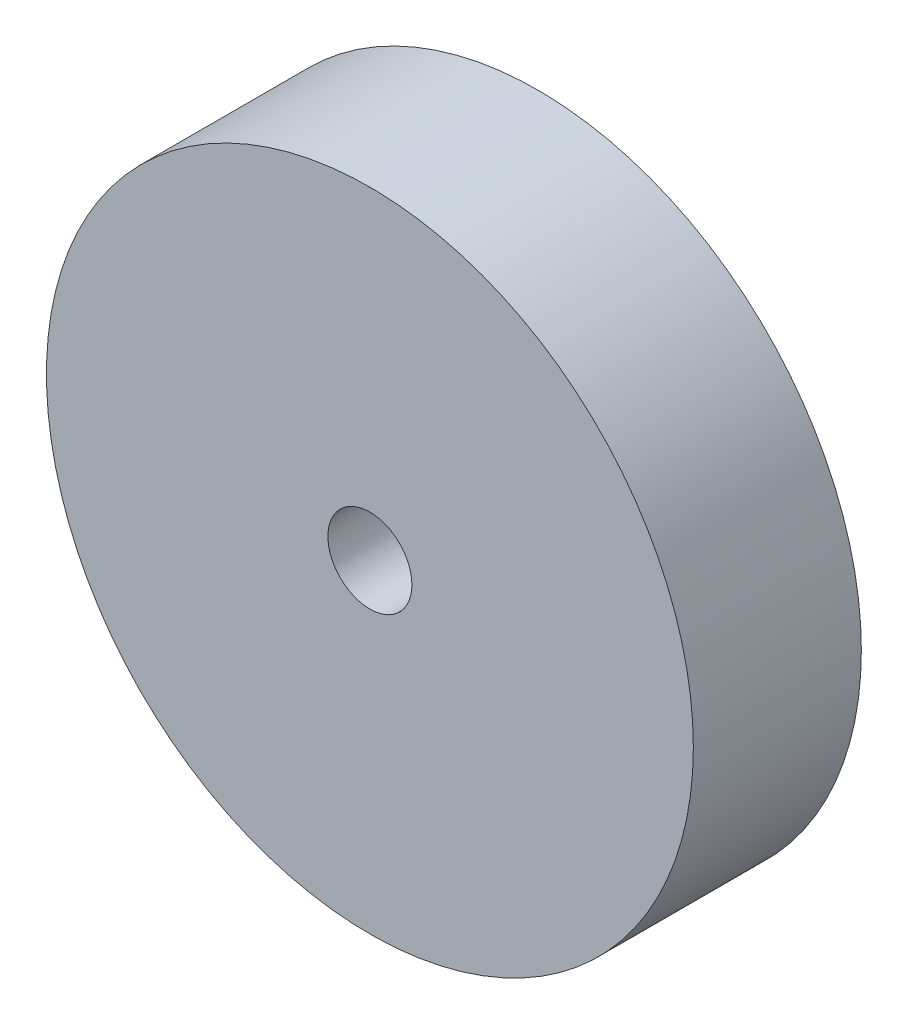
from build123d import *

# Parameters (mm, degrees)
SKETCH1_R           = 3.85
BOSS_EXTRUDE1_DEPTH = 2
CUT_EXTRUDE1_REACH  = 7.8
SKETCH2_R           = 0.5


with BuildPart() as part:
    # Sketch1 → Boss-Extrude1 (new body)
    with BuildSketch(Plane.XY):
        Circle(SKETCH1_R)
    extrude(amount=BOSS_EXTRUDE1_DEPTH)

    # Sketch2 → Cut-Extrude1 (cut, up to next)
    with BuildSketch(Plane.XY.offset(2), mode=Mode.PRIVATE) as cut_extrude1_sk1:
        Circle(SKETCH2_R)
    cut_extrude1_tool1 = extrude(cut_extrude1_sk1.sketch, amount=-CUT_EXTRUDE1_REACH, mode=Mode.PRIVATE) & part.part
    add(cut_extrude1_tool1.solids().sort_by_distance((0, 0, 2))[0], mode=Mode.SUBTRACT)


solid = part.part
